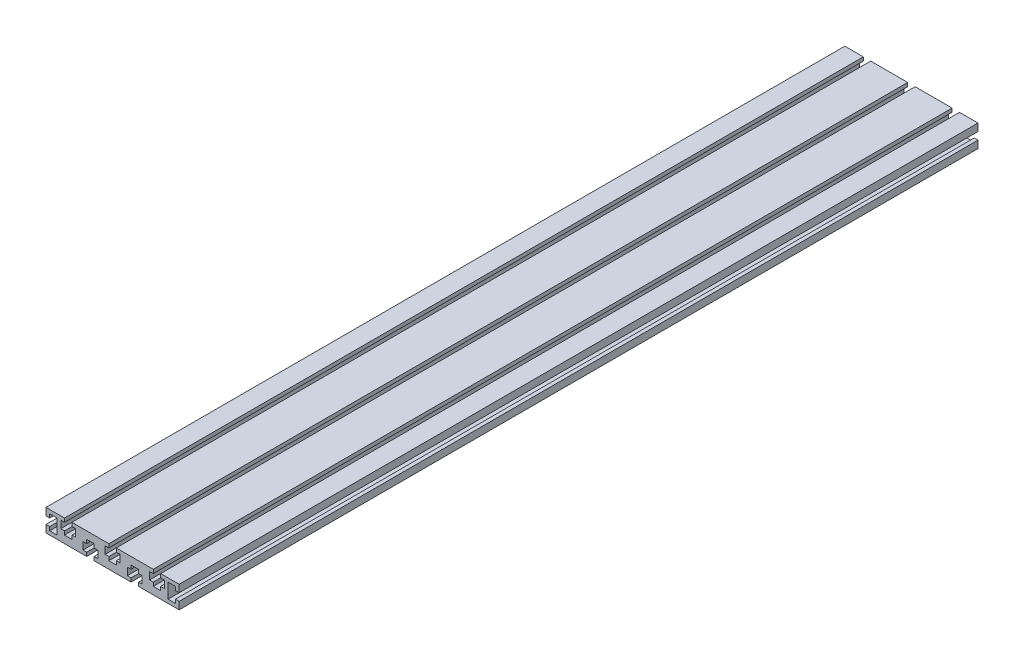
from build123d import *

# Parameters (mm, degrees)
BOSS_EXTRUDE1_DEPTH = 540


with BuildPart() as part:
    # Sketch1 → Boss-Extrude1 (new body)
    with BuildSketch(Plane.XY):
        Polygon((-45, -7.5), (-17.5, -7.5), (-17.5, -5), (-20, -5), (-20, 0), (-17.5, 0), (-17.5, 2.5), (-12.5, 2.5), (-12.5, 0), (-10, 0), (-10, -5), (-12.5, -5), (-12.5, -7.5), (12.5, -7.5), (12.5, -5), (10, -5), (10, 0), (12.5, 0), (12.5, 2.5), (17.5, 2.5), (17.5, 0), (20, 0), (20, -5), (17.5, -5), (17.5, -7.5), (45, -7.5), (45, -2.5), (42.5, -2.5), (42.5, -5), (37.5, -5), (37.5, 5), (42.5, 5), (42.5, 2.5), (45, 2.5), (45, 7.5), (32.5, 7.5), (32.5, 5), (35, 5), (35, 0), (32.5, 0), (32.5, -2.5), (27.5, -2.5), (27.5, 0), (25, 0), (25, 5), (27.5, 5), (27.5, 7.5), (2.5, 7.5), (2.5, 5), (5, 5), (5, 0), (2.5, 0), (2.5, -2.5), (-2.5, -2.5), (-2.5, 0), (-5, 0), (-5, 5), (-2.5, 5), (-2.5, 7.5), (-27.5, 7.5), (-27.5, 5), (-25, 5), (-25, 0), (-27.5, 0), (-27.5, -2.5), (-32.5, -2.5), (-32.5, 0), (-35, 0), (-35, 5), (-32.5, 5), (-32.5, 7.5), (-45, 7.5), (-45, 2.5), (-42.5, 2.5), (-42.5, 5), (-37.5, 5), (-37.5, -5), (-42.5, -5), (-42.5, -2.5), (-45, -2.5), align=None)
    extrude(amount=BOSS_EXTRUDE1_DEPTH)


solid = part.part
